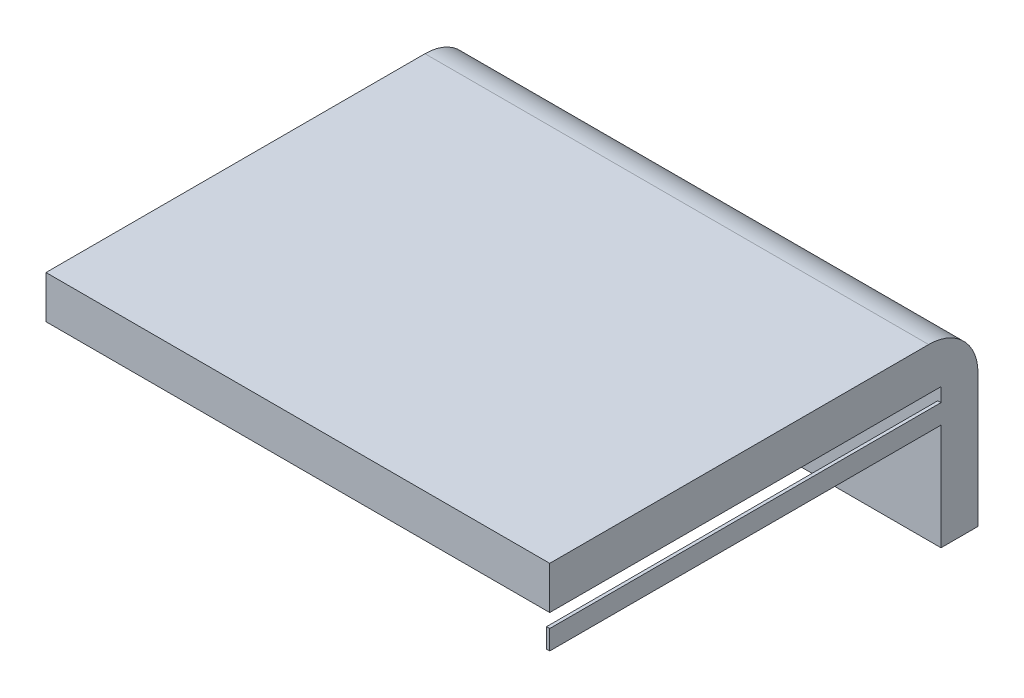
from build123d import *

# Parameters (mm, degrees)
SKETCH1_W           = 204.3
SKETCH1_H           = 173.7
BOSS_EXTRUDE2_DEPTH = 10
SKETCH4_W           = 204.3
SKETCH4_H           = 15
BOSS_EXTRUDE4_DEPTH = 68.9
SKETCH6_W           = 204.3
SKETCH6_H           = 5
CUT_EXTRUDE1_DEPTH  = 26
SKETCH5_W           = 204.3
SKETCH5_H           = 15
BOSS_EXTRUDE6_DEPTH = 7.3
FILLET1_R           = 20
SKETCH7_W           = 143.7
SKETCH7_H           = 7.3
BOSS_EXTRUDE7_DEPTH = 204.3
SKETCH9_W           = 158.7
SKETCH9_H           = 7.9
BOSS_EXTRUDE9_DEPTH = 1.3


with BuildPart() as part:
    # Sketch1 → Boss-Extrude2 (new body)
    with BuildSketch(Plane(origin=(0, 0, 0), x_dir=(1, 0, 0), z_dir=(0, 1, 0))):
        with Locations((272.329166667, 26.170833333)):
            Rectangle(SKETCH1_W, SKETCH1_H)
    extrude(amount=BOSS_EXTRUDE2_DEPTH)

    # Sketch4 → Boss-Extrude4 (add)
    with BuildSketch(Plane(origin=(0, 0, 0), x_dir=(-1, 0, 0), z_dir=(0, -1, 0))):
        with Locations((-272.329166667, 105.520833333)):
            Rectangle(SKETCH4_W, SKETCH4_H)
    extrude(amount=BOSS_EXTRUDE4_DEPTH)

    # Sketch6 → Cut-Extrude1 (cut)
    with BuildSketch(Plane.XY.offset(-98.020833333)):
        with Locations((272.329166667, -66.4)):
            Rectangle(SKETCH6_W, SKETCH6_H)
    extrude(amount=-CUT_EXTRUDE1_DEPTH, mode=Mode.SUBTRACT)

    # Sketch5 → Boss-Extrude6 (add)
    with BuildSketch(Plane.XZ):
        with Locations((272.329166667, 53.179166667)):
            Rectangle(SKETCH5_W, SKETCH5_H)
    extrude(amount=BOSS_EXTRUDE6_DEPTH)

    # Fillet1
    fillet1_edges = [part.edges().sort_by_distance(p)[0] for p in [
        (272.329166667, 10, -113.020833333),
    ]]
    fillet(fillet1_edges, radius=FILLET1_R)

    # Sketch7 → Boss-Extrude7 (add)
    with BuildSketch(Plane(origin=(374.479166667, 0, 0), x_dir=(0, 0, -1), z_dir=(1, 0, 0))):
        with Locations((26.170833333, -3.65)):
            Rectangle(SKETCH7_W, SKETCH7_H)
    extrude(amount=-BOSS_EXTRUDE7_DEPTH)

    # Sketch9 → Boss-Extrude9 (add)
    with BuildSketch(Plane(origin=(374.479166667, 0, 0), x_dir=(0, 0, -1), z_dir=(1, 0, 0))):
        with Locations((18.670833333, -16.85)):
            Rectangle(SKETCH9_W, SKETCH9_H)
    extrude(amount=-BOSS_EXTRUDE9_DEPTH)


solid = part.part
